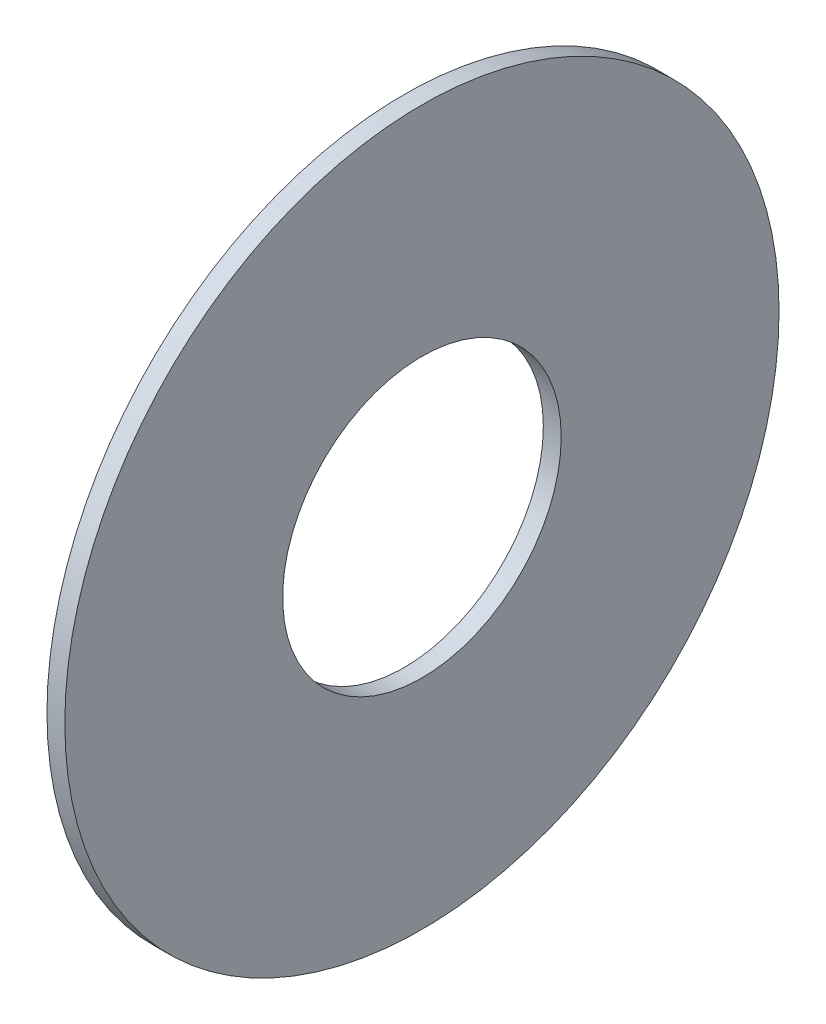
from build123d import *

# Parameters (mm, degrees)
SKETCH1_R           = 63.5
SKETCH1_R_2         = 24.765
BOSS_EXTRUDE1_DEPTH = 3.175


with BuildPart() as part:
    # Sketch1 → Boss-Extrude1 (new body)
    with BuildSketch(Plane(origin=(0, 0, 0), x_dir=(0, 0, -1), z_dir=(1, 0, 0))):
        Circle(SKETCH1_R)
        Circle(SKETCH1_R_2, mode=Mode.SUBTRACT)
    extrude(amount=BOSS_EXTRUDE1_DEPTH)


solid = part.part
